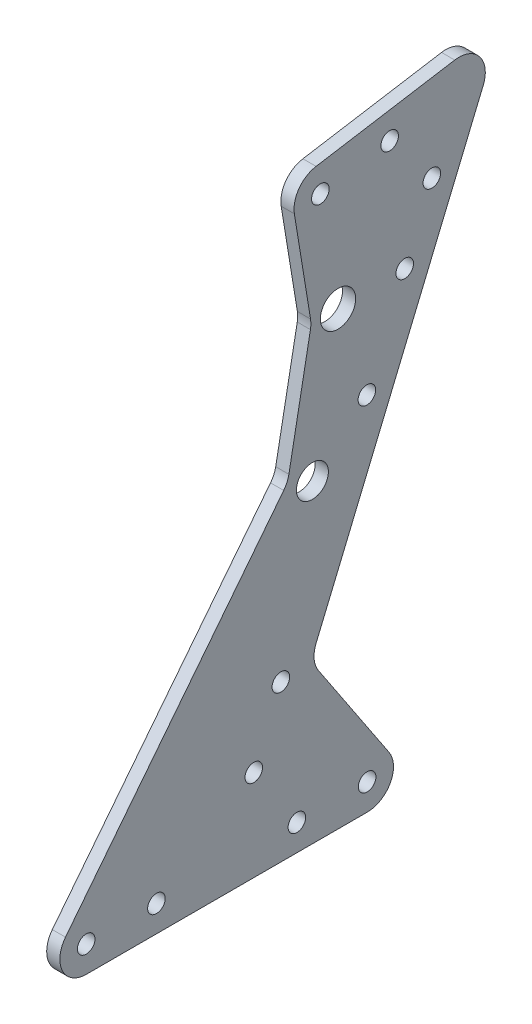
from build123d import *

# Parameters (mm, degrees)
BOSS_EXTRUDE1_START = 12.528612
SKETCH2_R           = 3.175
SKETCH2_R_2         = 5.781305793
SKETCH2_R_3         = 6.382098514
BOSS_EXTRUDE1_DEPTH = 4.7625
FILLET1_R           = 9.525


with BuildPart() as part:
    # Sketch2 → Boss-Extrude1 (new body)
    with BuildSketch(Plane(origin=(0, 0, 0), x_dir=(0, 0, -1), z_dir=(1, 0, 0)).offset(BOSS_EXTRUDE1_START)):
        with BuildLine():
            ThreePointArc((-1144.374252892, 135.379574554), (-1135.977897239, 140.407148985), (-1136.445227254, 150.182469725))
            Line((-1136.445227254, 150.182469725), (-1164.81319381, 192.799900886))
            Line((-1164.81319381, 192.799900886), (-1112.182497939, 318.610437742))
            Line((-1112.182497939, 318.610437742), (-1095.74378362, 357.906203065))
            Line((-1095.74378362, 357.906203065), (-1137.77556383, 350.998384801))
            Line((-1137.77556383, 350.998384801), (-1162.839331646, 346.879217061))
            ThreePointArc((-1162.839331646, 346.879217061), (-1169.029486958, 343.038885374), (-1170.695468345, 335.947293432))
            Line((-1170.695468345, 335.947293432), (-1164.57634177, 298.423200658))
            Line((-1164.57634177, 298.423200658), (-1173.106250375, 253.07288466))
            Line((-1173.106250375, 253.07288466), (-1253.464218567, 150.788964003))
            ThreePointArc((-1253.464218567, 150.788964003), (-1254.540886843, 140.740633182), (-1245.974252892, 135.379574554))
            Line((-1245.974252892, 135.379574554), (-1144.374252892, 135.379574554))
        make_face()
        with Locations((-1245.974252892, 144.904574554)):
            Circle(SKETCH2_R, mode=Mode.SUBTRACT)
        with Locations((-1220.574252892, 144.904574554)):
            Circle(SKETCH2_R, mode=Mode.SUBTRACT)
        with Locations((-1185.371762566, 168.336842549)):
            Circle(SKETCH2_R, mode=Mode.SUBTRACT)
        with Locations((-1169.774252892, 144.904574554)):
            Circle(SKETCH2_R, mode=Mode.SUBTRACT)
        with Locations((-1144.374252892, 144.904574554)):
            Circle(SKETCH2_R, mode=Mode.SUBTRACT)
        with Locations((-1175.56927224, 191.769110545)):
            Circle(SKETCH2_R, mode=Mode.SUBTRACT)
        with Locations((-1164.176264161, 249.021430388)):
            Circle(SKETCH2_R_2, mode=Mode.SUBTRACT)
        with Locations((-1144.465794272, 266.120118002)):
            Circle(SKETCH2_R, mode=Mode.SUBTRACT)
        with Locations((-1154.90639106, 298.305859313)):
            Circle(SKETCH2_R_3, mode=Mode.SUBTRACT)
        with Locations((-1130.772088763, 298.854103619)):
            Circle(SKETCH2_R, mode=Mode.SUBTRACT)
        with Locations((-1161.294643743, 337.48030413)):
            Circle(SKETCH2_R, mode=Mode.SUBTRACT)
        with Locations((-1136.230875927, 341.59947187)):
            Circle(SKETCH2_R, mode=Mode.SUBTRACT)
        with Locations((-1120.969598437, 322.286371614)):
            Circle(SKETCH2_R, mode=Mode.SUBTRACT)
    extrude(amount=BOSS_EXTRUDE1_DEPTH)

    # Fillet1
    fillet1_edges = [part.edges().sort_by_distance(p)[0] for p in [
        (14.909862, 357.906203065, 1095.74378362),
        (14.909862, 192.799900886, 1164.81319381),
        (14.909862, 253.07288466, 1173.106250375),
        (14.909862, 298.423200658, 1164.57634177),
    ]]
    fillet(fillet1_edges, radius=FILLET1_R)


solid = part.part
